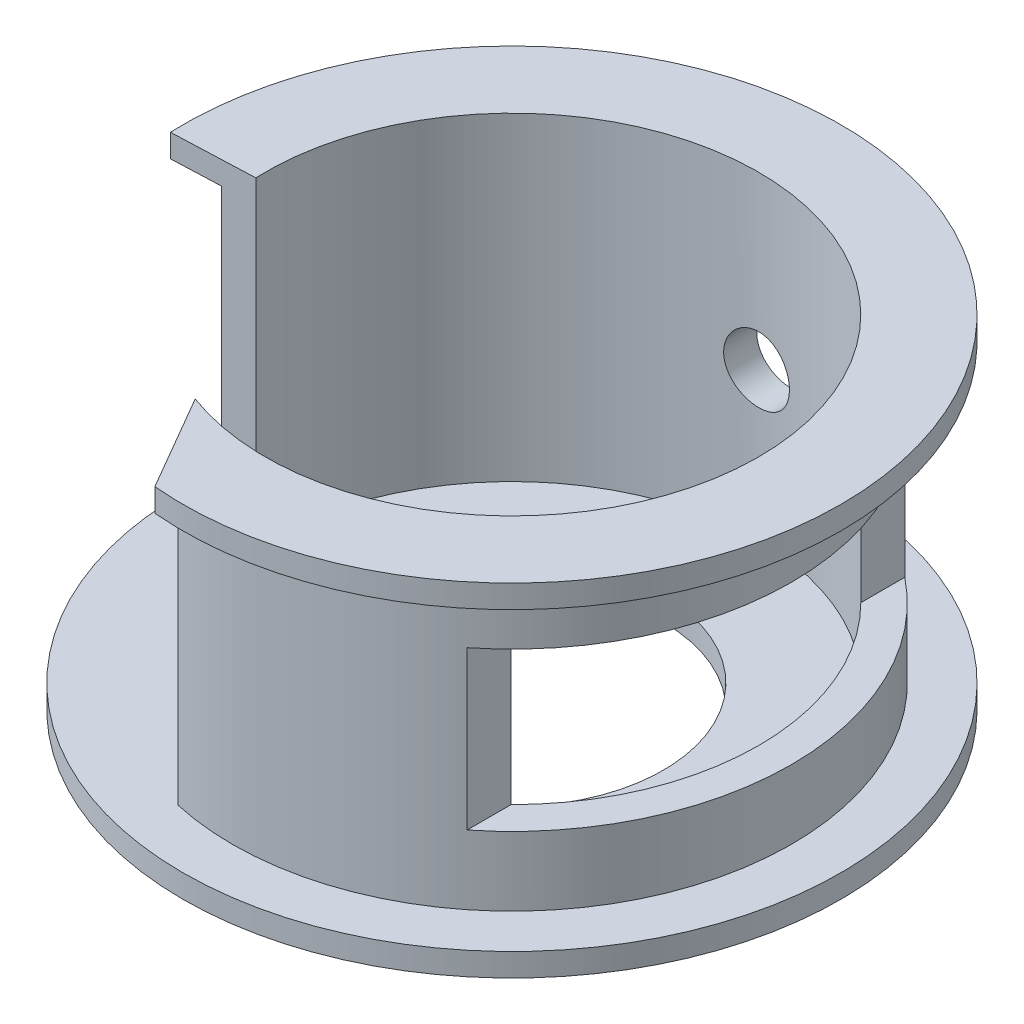
from build123d import *

# Parameters (mm, degrees)
SKETCH1_R           = 5
BOSS_EXTRUDE1_DEPTH = 0.35
SKETCH2_R           = 4.25
SKETCH2_R_2         = 3.75
BOSS_EXTRUDE6_DEPTH = 4.5
SKETCH5_R           = 5
SKETCH5_R_2         = 3.75
BOSS_EXTRUDE7_DEPTH = 0.35
SKETCH9_R           = 2.3
CUT_EXTRUDE5_DEPTH  = 11.4
CUT_EXTRUDE6_DEPTH  = 11.4
CUT_EXTRUDE8_START  = -4.85
CUT_EXTRUDE8_DEPTH  = 4.85
SKETCH12_R          = 0.5
CUT_EXTRUDE9_DEPTH  = 4.85


with BuildPart() as part:
    # Sketch1 → Boss-Extrude1 (new body)
    with BuildSketch(Plane(origin=(0, 0, 0), x_dir=(1, 0, 0), z_dir=(0, 1, 0))):
        with Locations(Location((-49.622774045, -6.018603783, 0), (0, 0, 270))):
            Circle(SKETCH1_R)
    extrude(amount=BOSS_EXTRUDE1_DEPTH)

    # Sketch2 → Boss-Extrude6 (add)
    with BuildSketch(Plane(origin=(0, 0.35, 0), x_dir=(1, 0, 0), z_dir=(0, 1, 0))):
        with Locations(Location((-49.622774045, -6.018603783, 0), (0, 0, 270))):
            Circle(SKETCH2_R)
        with Locations(Location((-49.622774045, -6.018603783, 0), (0, 0, 270))):
            Circle(SKETCH2_R_2, mode=Mode.SUBTRACT)
    extrude(amount=BOSS_EXTRUDE6_DEPTH)

    # Sketch5 → Boss-Extrude7 (add)
    with BuildSketch(Plane(origin=(0, 4.85, 0), x_dir=(1, 0, 0), z_dir=(0, 1, 0))):
        with Locations(Location((-49.622774045, -6.018603783, 0), (0, 0, 270))):
            Circle(SKETCH5_R)
        with Locations(Location((-49.622774045, -6.018603783, 0), (0, 0, 270))):
            Circle(SKETCH5_R_2, mode=Mode.SUBTRACT)
    extrude(amount=BOSS_EXTRUDE7_DEPTH)

    # Sketch9 → Cut-Extrude5 (cut)
    with BuildSketch(Plane(origin=(0, 0.35, 0), x_dir=(1, 0, 0), z_dir=(0, 1, 0))):
        with Locations(Location((-49.622774045, -6.018603783, 0), (0, 0, 270))):
            Circle(SKETCH9_R)
    extrude(amount=-CUT_EXTRUDE5_DEPTH, mode=Mode.SUBTRACT)

    # Sketch10 → Cut-Extrude6 (cut)
    with BuildSketch(Plane.XY):
        Polygon((-43.20579759, 3.8), (-43.20579759, 1.4), (-46.977708805, 1.4), (-46.977708805, 2.6), (-46.977708805, 3.8), align=None)
    extrude(amount=CUT_EXTRUDE6_DEPTH, mode=Mode.SUBTRACT)

    # Sketch11 → Cut-Extrude8 (cut)
    with BuildSketch(Plane(origin=(0, 5.2, 0), x_dir=(1, 0, 0), z_dir=(0, 1, 0)).offset(CUT_EXTRUDE8_START)):
        with BuildLine():
            Line((-53.369890601, -6.165632753), (-54.618929453, -6.21464241))
            ThreePointArc((-54.618929453, -6.21464241), (-53.246537308, -9.463649474), (-50.071032009, -10.998469725))
            Line((-50.071032009, -10.998469725), (-50.91884618, -9.53750944))
            ThreePointArc((-50.91884618, -9.53750944), (-52.656060405, -8.223524158), (-53.369890601, -6.165632753))
        make_face()
    extrude(amount=CUT_EXTRUDE8_DEPTH, mode=Mode.SUBTRACT)

    # Sketch12 → Cut-Extrude9 (cut)
    with BuildSketch(Plane.XY):
        with Locations(Location((-49.621140094, 2.6, 0), (0, 0, 180))):
            Circle(SKETCH12_R)
    extrude(amount=CUT_EXTRUDE9_DEPTH, mode=Mode.SUBTRACT)


solid = part.part
